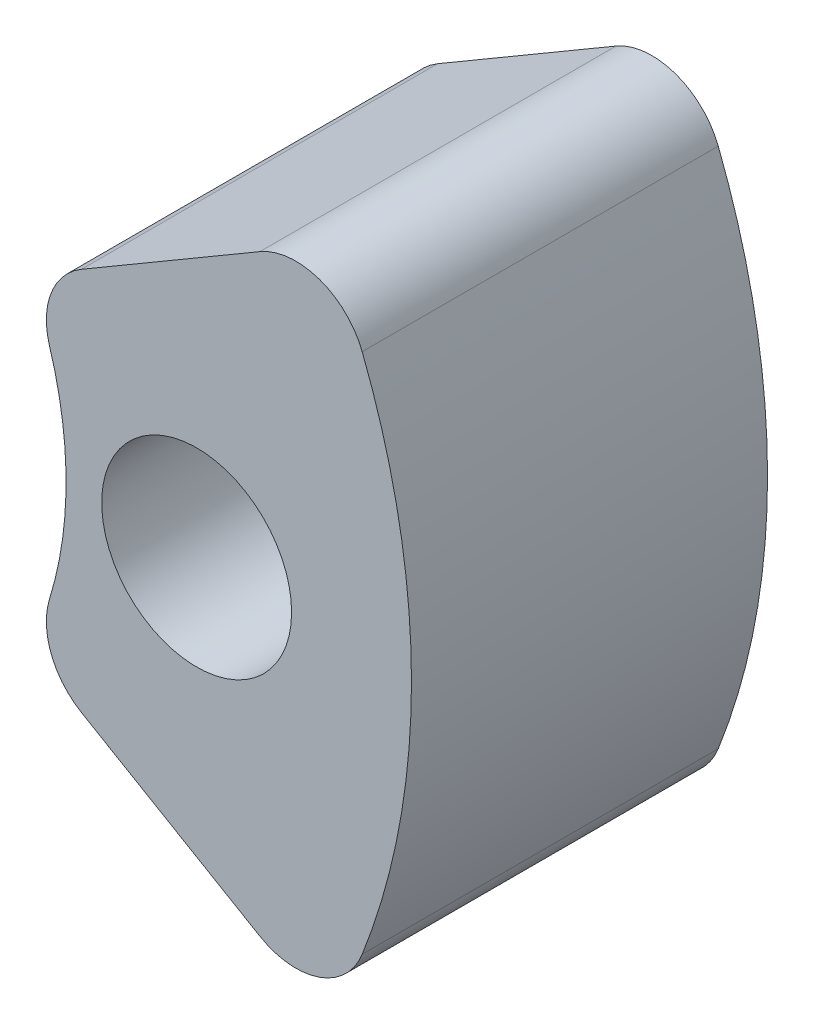
from build123d import *

# Parameters (mm, degrees)
CORPO_DEPTH                     = 15
REBAIXO_PARAFUSO_M4_D           = 4.5
REBAIXO_PARAFUSO_M4_DEPTH       = 30
REBAIXO_PARAFUSO_M4_CBORE_D     = 8
REBAIXO_PARAFUSO_M4_CBORE_DEPTH = 9
REBAIXO_PARAFUSO_M4_TIP         = 1.351936393


with BuildPart() as part:
    # Sketch1 → Corpo (new body)
    with BuildSketch(Plane.XY):
        with BuildLine():
            Line((16.252058195, 8.088672021), (23.764502557, 12.488672021))
            ThreePointArc((23.764502557, 12.488672021), (26.263743802, 12.734356122), (28.074119126, 10.993922652))
            ThreePointArc((28.074119126, 10.993922652), (30.15, 0), (28.074119126, -10.993922652))
            ThreePointArc((28.074119126, -10.993922652), (26.263743802, -12.734356122), (23.764502557, -12.488672021))
            Line((23.764502557, -12.488672021), (16.252058195, -8.088672021))
            ThreePointArc((16.252058195, -8.088672021), (14.971668435, -6.585929552), (14.902386515, -4.612903226))
            ThreePointArc((14.902386515, -4.612903226), (15.6, 0), (14.902386515, 4.612903226))
            ThreePointArc((14.902386515, 4.612903226), (14.971668435, 6.585929552), (16.252058195, 8.088672021))
        make_face()
    extrude(amount=CORPO_DEPTH)

    # Rebaixo - Parafuso M4
    with Locations(Plane.XY.offset(15)):
        with Locations((21.1, 0)):
            CounterBoreHole(REBAIXO_PARAFUSO_M4_D / 2, REBAIXO_PARAFUSO_M4_CBORE_D / 2, REBAIXO_PARAFUSO_M4_CBORE_DEPTH, depth=REBAIXO_PARAFUSO_M4_DEPTH)
            with Locations((0, 0, -(REBAIXO_PARAFUSO_M4_DEPTH + REBAIXO_PARAFUSO_M4_TIP / 2))):  # 118° drill point
                Cone(0, REBAIXO_PARAFUSO_M4_D / 2, REBAIXO_PARAFUSO_M4_TIP, mode=Mode.SUBTRACT)


solid = part.part
